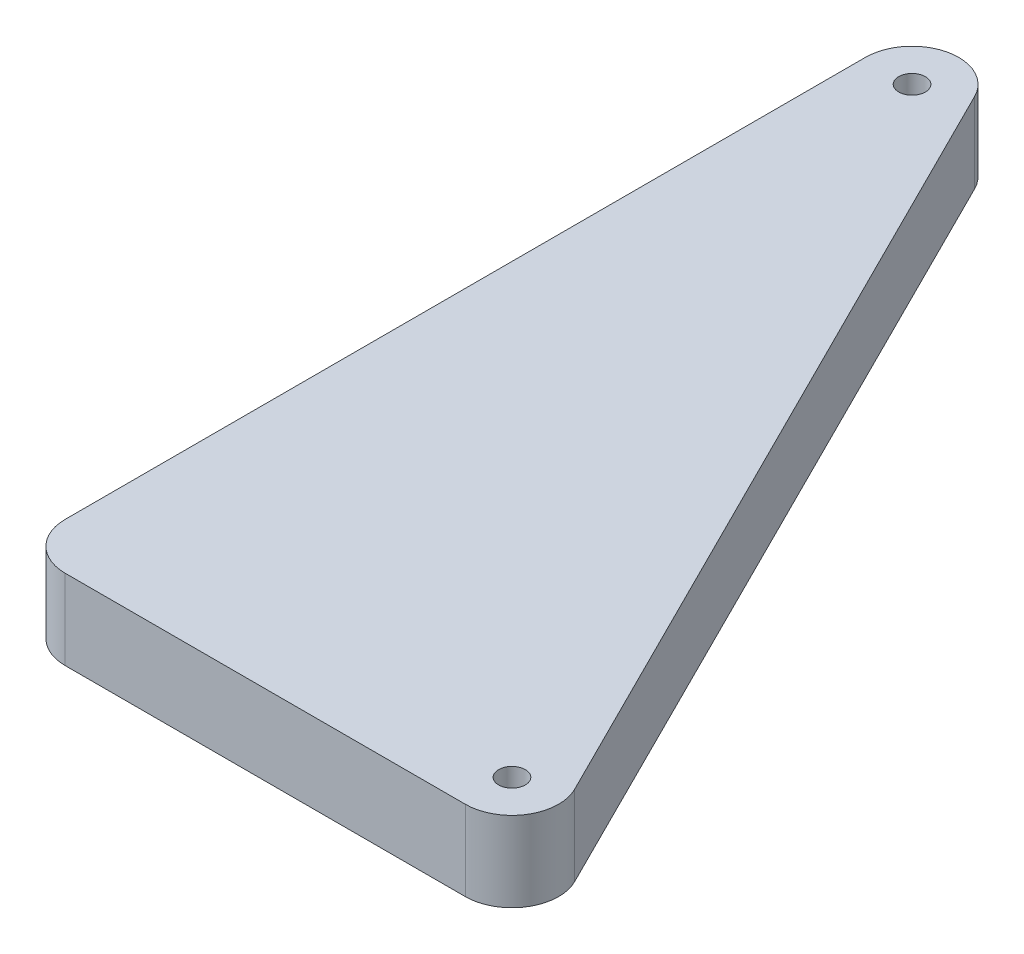
from build123d import *

# Parameters (mm, degrees)
SKETCH1_R           = 1
BOSS_EXTRUDE1_DEPTH = 6


with BuildPart() as part:
    # Sketch1 → Boss-Extrude1 (new body)
    with BuildSketch(Plane(origin=(0, 0, 0), x_dir=(1, 0, 0), z_dir=(0, 1, 0))):
        with BuildLine():
            Line((30, -63.5), (0, -63.5))
            ThreePointArc((0, -63.5), (-2.474873734, -62.474873734), (-3.5, -60))
            Line((-3.5, -60), (-3.5, 0))
            ThreePointArc((-3.5, 0), (-0.804135222, 3.406371463), (3.130495168, 1.565247584))
            Line((3.130495168, 1.565247584), (33.130495168, -58.434752416))
            ThreePointArc((33.130495168, -58.434752416), (32.977277829, -61.840058892), (30, -63.5))
        make_face()
        with Locations(Location((0, 0, 0), (0, 0, 270))):
            Circle(SKETCH1_R, mode=Mode.SUBTRACT)
        with Locations(Location((30, -60, 0), (0, 0, 270))):
            Circle(SKETCH1_R, mode=Mode.SUBTRACT)
    extrude(amount=BOSS_EXTRUDE1_DEPTH)


solid = part.part
